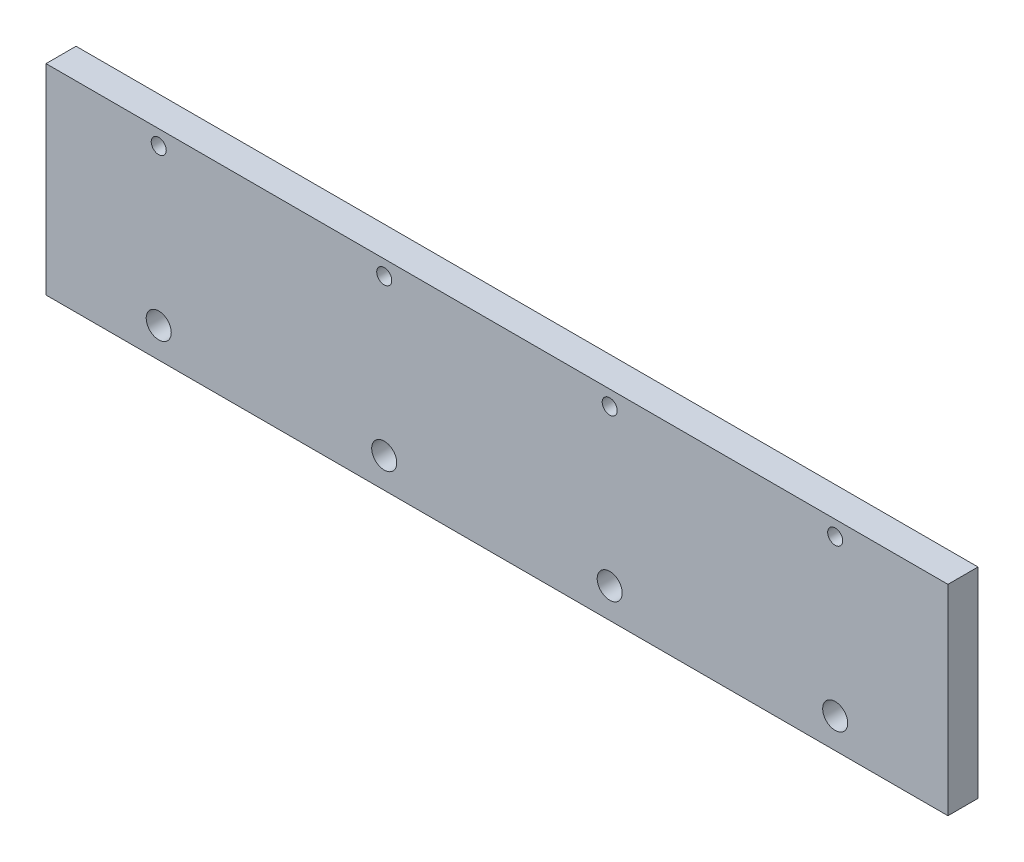
from build123d import *

# Parameters (mm, degrees)
SKETCH1_W           = 360
SKETCH1_H           = 80
BOSS_EXTRUDE1_DEPTH = 12
CUT_EXTRUDE1_REACH  = 186.781
SKETCH2_R           = 3
SKETCH2_R_2         = 5
LPATTERN1_COUNT     = 4
LPATTERN1_PITCH     = 90


with BuildPart() as part:
    # Sketch1 → Boss-Extrude1 (new body)
    with BuildSketch(Plane.XY):
        Rectangle(SKETCH1_W, SKETCH1_H)
    extrude(amount=BOSS_EXTRUDE1_DEPTH)

    # Sketch2 → Cut-Extrude1 (cut, up to next)
    with BuildSketch(Plane.XY.offset(12), mode=Mode.PRIVATE) as cut_extrude1_sk1:
        with Locations((-135, 34)):
            Circle(SKETCH2_R)
    cut_extrude1_tool1 = extrude(cut_extrude1_sk1.sketch, amount=-CUT_EXTRUDE1_REACH, mode=Mode.PRIVATE) & part.part
    # Sketch2 → Cut-Extrude1 (cut, up to next)
    with BuildSketch(Plane.XY.offset(12), mode=Mode.PRIVATE) as cut_extrude1_sk2:
        with Locations((-135, -28)):
            Circle(SKETCH2_R_2)
    cut_extrude1_tool2 = extrude(cut_extrude1_sk2.sketch, amount=-CUT_EXTRUDE1_REACH, mode=Mode.PRIVATE) & part.part
    cut_extrude1_1 = cut_extrude1_tool1.solids().sort_by_distance((-135, 34, 12))[0]
    add(cut_extrude1_1, mode=Mode.SUBTRACT)
    cut_extrude1_2 = cut_extrude1_tool2.solids().sort_by_distance((-135, -28, 12))[0]
    add(cut_extrude1_2, mode=Mode.SUBTRACT)
    cut_extrude1 = cut_extrude1_1 + cut_extrude1_2  # Cut-Extrude1 as one shape, for the pattern or mirror that repeats it

    # LPattern1: Cut-Extrude1 ×4
    with Locations(*[(i * LPATTERN1_PITCH, 0, 0) for i in range(1, LPATTERN1_COUNT)]):
        add(cut_extrude1, mode=Mode.SUBTRACT)


solid = part.part
